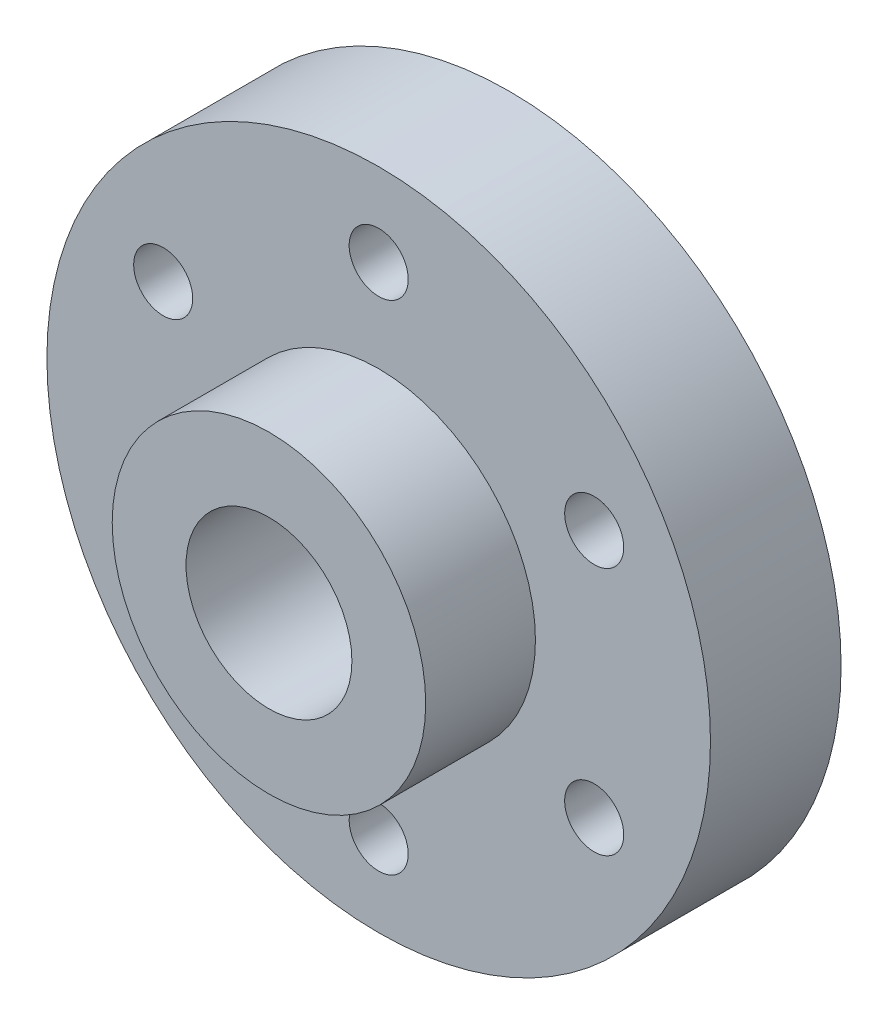
from build123d import *

# Parameters (mm, degrees)
SKETCH2_R           = 12.7
SKETCH2_R_2         = 3.175
BOSS_EXTRUDE1_DEPTH = 5
SKETCH3_R           = 6
SKETCH3_R_2         = 3.175
BOSS_EXTRUDE2_DEPTH = 4.2
CUT_EXTRUDE1_REACH  = 20.643
SKETCH4_R           = 1.1303
CIRPATTERN1_COUNT   = 6


with BuildPart() as part:
    # Sketch2 → Boss-Extrude1 (new body)
    with BuildSketch(Plane.XY):
        Circle(SKETCH2_R)
        Circle(SKETCH2_R_2, mode=Mode.SUBTRACT)
    extrude(amount=BOSS_EXTRUDE1_DEPTH)

    # Sketch3 → Boss-Extrude2 (add)
    with BuildSketch(Plane.XY.offset(5)):
        Circle(SKETCH3_R)
        Circle(SKETCH3_R_2, mode=Mode.SUBTRACT)
    extrude(amount=BOSS_EXTRUDE2_DEPTH)

    # Sketch4 → Cut-Extrude1 (cut, up to next)
    with BuildSketch(Plane.XY.offset(5), mode=Mode.PRIVATE) as cut_extrude1_sk1:
        with Locations((0, 9.525)):
            Circle(SKETCH4_R)
    cut_extrude1_tool1 = extrude(cut_extrude1_sk1.sketch, amount=-CUT_EXTRUDE1_REACH, mode=Mode.PRIVATE) & part.part
    cut_extrude1 = cut_extrude1_tool1.solids().sort_by_distance((0, 9.525, 5))[0]
    add(cut_extrude1, mode=Mode.SUBTRACT)

    # CirPattern1: Cut-Extrude1 ×6 about axis
    cirpattern1_axis = Axis((0, 0, 0), (0, 0, 1))
    for i in range(1, CIRPATTERN1_COUNT):
        add(cut_extrude1.rotate(cirpattern1_axis, i * 360 / CIRPATTERN1_COUNT), mode=Mode.SUBTRACT)


solid = part.part
